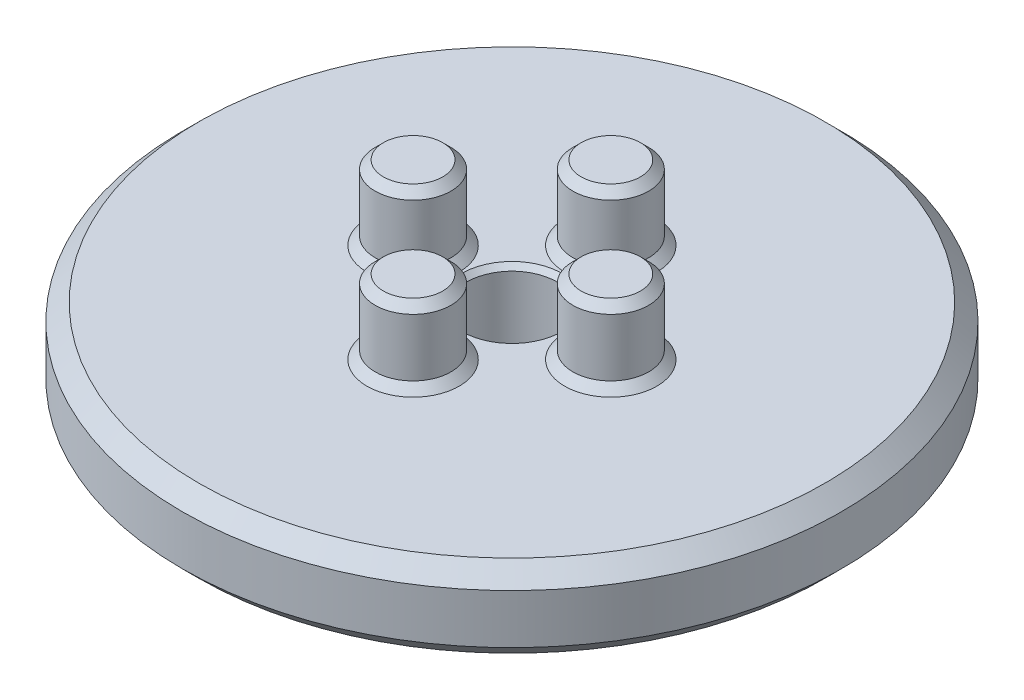
from build123d import *

# Parameters (mm, degrees)
SKETCH_1_R                           = 20
EXTRUDE_1_DEPTH                      = 5
CUT_EXTRUDE_START                    = -5
SKETCH_4_R                           = 2.75
CUT_EXTRUDE_3_DEPTH                  = 15
SKETCH_7_R                           = 2.3
EXTRUDE_3_DEPTH                      = 4.5
CHAMFER_3_SIZE                       = 0.5
PATTERN_CIRCULAR_1_COUNT             = 4
CHAMFER_3_OF_PATTERN_CIRCULAR_1_SIZE = 0.5
CHAMFER_4_SIZE                       = 0.3
CHAMFER_5_SIZE                       = 1


with BuildPart() as part:
    # 草图1 → 凸台-拉伸1 (new body)
    with BuildSketch(Plane(origin=(0, 0, 0), x_dir=(1, 0, 0), z_dir=(0, 1, 0))):
        with Locations(Location((0, 0, 0), (0, 0, 270))):
            Circle(SKETCH_1_R)
    extrude(amount=EXTRUDE_1_DEPTH)

    # 草图4 → 切除-拉伸3 (cut)
    with BuildSketch(Plane(origin=(0, 5, 0), x_dir=(1, 0, 0), z_dir=(0, 1, 0)).offset(CUT_EXTRUDE_START)):
        with Locations(Location((0, 0, 0), (0, 0, 270))):
            Circle(SKETCH_4_R)
    extrude(amount=CUT_EXTRUDE_3_DEPTH, mode=Mode.SUBTRACT)

    # 草图7 → 凸台-拉伸3 (add)
    with BuildSketch(Plane(origin=(0, 5, 0), x_dir=(1, 0, 0), z_dir=(0, 1, 0))):
        with Locations(Location((6, 0, 0), (0, 0, 270))):
            Circle(SKETCH_7_R)
    extrude_3 = extrude(amount=EXTRUDE_3_DEPTH)

    # 倒角3
    chamfer_3_edges = [part.edges().sort_by_distance(p)[0] for p in [
        (6, 5, -2.3),
        (6, 9.5, -2.3),
    ]]
    chamfer(chamfer_3_edges, length=CHAMFER_3_SIZE)

    # 阵列(圆周)1: 凸台-拉伸3 ×4 about axis
    pattern_circular_1_axis = Axis((0, 0, 0), (0, 1, 0))
    for i in range(1, PATTERN_CIRCULAR_1_COUNT):
        add(extrude_3.rotate(pattern_circular_1_axis, i * 360 / PATTERN_CIRCULAR_1_COUNT))

    # 倒角3 of 阵列(圆周)1
    chamfer_3_of_pattern_circular_1_edges = [part.edges().sort_by_distance(p)[0] for p in [
        (-2.3, 5, -6),
        (-2.3, 9.5, -6),
        (-6, 5, 2.3),
        (-6, 9.5, 2.3),
        (2.3, 5, 6),
        (2.3, 9.5, 6),
    ]]
    chamfer(chamfer_3_of_pattern_circular_1_edges, length=CHAMFER_3_OF_PATTERN_CIRCULAR_1_SIZE)

    # 倒角4
    chamfer_4_edges = [part.edges().sort_by_distance(p)[0] for p in [
        (0, 5, -2.75),
        (0, 0, -2.75),
    ]]
    chamfer(chamfer_4_edges, length=CHAMFER_4_SIZE)

    # 倒角5
    chamfer_5_edges = [part.edges().sort_by_distance(p)[0] for p in [
        (0, 0, -20),
        (0, 5, -20),
    ]]
    chamfer(chamfer_5_edges, length=CHAMFER_5_SIZE)


solid = part.part
